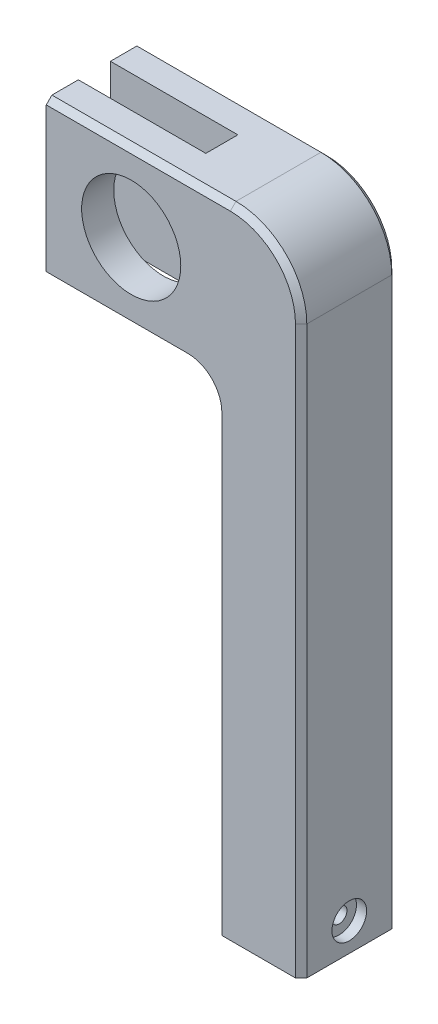
from build123d import *

# Parameters (mm, degrees)
BOSS_EXTRUDE1_DEPTH                     = 17
CUT_EXTRUDE1_REACH                      = 244.928
SKETCH3_W                               = 45
SKETCH3_H                               = 11.33
FILLET1_R                               = 25
FILLET2_R                               = 10
SKETCH4_R                               = 17.5
CUT_EXTRUDE2_DEPTH                      = 11.335
CUT_EXTRUDE3_REACH                      = 246.706
SKETCH5_R                               = 11.375
CHAMFER1_SIZE                           = 2
CBORE_FOR_M5_HEX_HEAD_BOLT1_D           = 5.5
CBORE_FOR_M5_HEX_HEAD_BOLT1_CBORE_D     = 12.24
CBORE_FOR_M5_HEX_HEAD_BOLT1_CBORE_DEPTH = 3.58
F_3_0MM_DOWEL_HOLE1_D                   = 3
F_3_0MM_DOWEL_HOLE1_DEPTH               = 20
F_3_0MM_DOWEL_HOLE1_TIP                 = 0.901290929


with BuildPart() as part:
    # Sketch1 → Boss-Extrude1 (new, symmetric)
    with BuildSketch(Plane.XY):
        Polygon((0, 0), (-30, 0), (-30, 170), (-90, 170), (-90, 225), (0, 225), align=None)
    extrude(amount=BOSS_EXTRUDE1_DEPTH, both=True)

    # Sketch3 → Cut-Extrude1 (cut, up to next)
    with BuildSketch(Plane(origin=(0, 225, 0), x_dir=(1, 0, 0), z_dir=(0, 1, 0)), mode=Mode.PRIVATE) as cut_extrude1_sk1:
        with Locations((-67.5, 0)):
            Rectangle(SKETCH3_W, SKETCH3_H)
    cut_extrude1_tool1 = extrude(cut_extrude1_sk1.sketch, amount=-CUT_EXTRUDE1_REACH, mode=Mode.PRIVATE) & part.part
    add(cut_extrude1_tool1.solids().sort_by_distance((-67.5, 225, 0))[0], mode=Mode.SUBTRACT)

    # Fillet1
    fillet1_edges = [part.edges().sort_by_distance(p)[0] for p in [
        (0, 225, 0),
    ]]
    fillet(fillet1_edges, radius=FILLET1_R)

    # Fillet2
    fillet2_edges = [part.edges().sort_by_distance(p)[0] for p in [
        (-30, 170, 0),
    ]]
    fillet(fillet2_edges, radius=FILLET2_R)

    # Sketch4 → Cut-Extrude2 (cut)
    with BuildSketch(Plane.XY.offset(17)):
        with Locations((-60, 197.5)):
            Circle(SKETCH4_R)
    extrude(amount=-CUT_EXTRUDE2_DEPTH, mode=Mode.SUBTRACT)

    # Sketch5 → Cut-Extrude3 (cut, up to next)
    with BuildSketch(Plane(origin=(0, 0, -17), x_dir=(-1, 0, 0), z_dir=(0, 0, -1)), mode=Mode.PRIVATE) as cut_extrude3_sk1:
        with Locations((60, 197.5)):
            Circle(SKETCH5_R)
    cut_extrude3_tool1 = extrude(cut_extrude3_sk1.sketch, amount=-CUT_EXTRUDE3_REACH, mode=Mode.PRIVATE) & part.part
    add(cut_extrude3_tool1.solids().sort_by_distance((-60, 197.5, -17))[0], mode=Mode.SUBTRACT)

    # Chamfer1
    chamfer1_edges = [part.edges().sort_by_distance(p)[0] for p in [
        (-65, 170, -17),
        (-57.5, 225, 17),
        (-7.32233047, 217.67766953, 17),
        (-57.5, 225, -17),
        (-7.32233047, 217.67766953, -17),
        (-30, 80, 17),
        (-30, 80, -17),
        (-32.928932188, 167.071067812, 17),
        (-32.928932188, 167.071067812, -17),
        (0, 100, -17),
        (-65, 170, 17),
        (0, 100, 17),
    ]]
    chamfer(chamfer1_edges, length=CHAMFER1_SIZE)

    # CBORE for M5 Hex Head Bolt1 (through all)
    with Locations(Plane(origin=(0, 0, 0), x_dir=(0, 0, -1), z_dir=(1, 0, 0))):
        with Locations((0, 10)):
            CounterBoreHole(CBORE_FOR_M5_HEX_HEAD_BOLT1_D / 2, CBORE_FOR_M5_HEX_HEAD_BOLT1_CBORE_D / 2, CBORE_FOR_M5_HEX_HEAD_BOLT1_CBORE_DEPTH)

    # Ø3.0mm Dowel Hole1
    with Locations(Plane.ZY.offset(90)):
        with Locations((11.33, 220), (-11.33, 175), (-11.33, 220), (11.33, 175)):
            Hole(F_3_0MM_DOWEL_HOLE1_D / 2, depth=F_3_0MM_DOWEL_HOLE1_DEPTH)
            with Locations((0, 0, -(F_3_0MM_DOWEL_HOLE1_DEPTH + F_3_0MM_DOWEL_HOLE1_TIP / 2))):  # 118° drill point
                Cone(0, F_3_0MM_DOWEL_HOLE1_D / 2, F_3_0MM_DOWEL_HOLE1_TIP, mode=Mode.SUBTRACT)


solid = part.part
